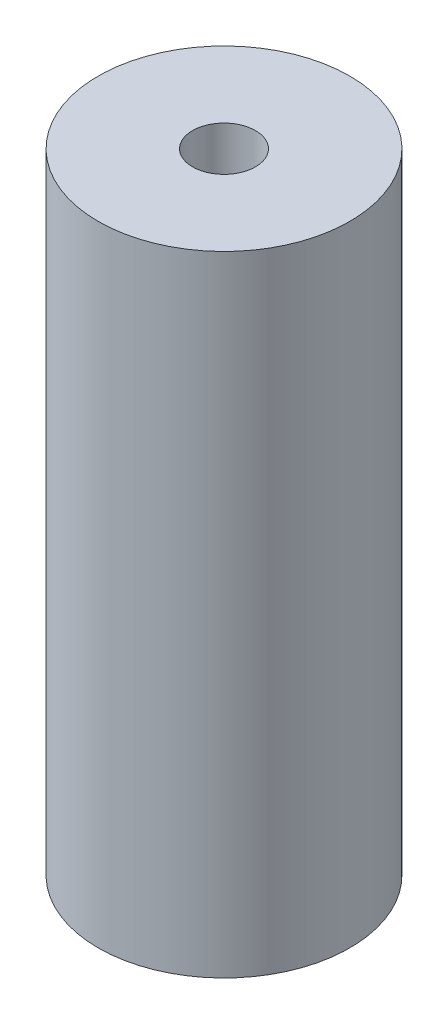
from build123d import *

# Parameters (mm, degrees)
SKETCH_1_R          = 40
EXTRUDE_1_DEPTH     = 200
SKETCH_2_R          = 10
CUT_EXTRUDE_1_DEPTH = 208.846096908


with BuildPart() as part:
    # 草图1 → 凸台-拉伸1 (new body)
    with BuildSketch(Plane(origin=(0, 0, 0), x_dir=(1, 0, 0), z_dir=(0, 1, 0))):
        with Locations(Location((0, 0, 0), (0, 0, 270))):
            Circle(SKETCH_1_R)
    extrude(amount=EXTRUDE_1_DEPTH)

    # 草图2 → 切除-拉伸1 (cut, through all)
    with BuildSketch(Plane(origin=(0, 200, 0), x_dir=(1, 0, 0), z_dir=(0, 1, 0))):
        with Locations(Location((0, 0, 0), (0, 0, 270))):
            Circle(SKETCH_2_R)
    extrude(amount=-CUT_EXTRUDE_1_DEPTH, mode=Mode.SUBTRACT)


solid = part.part
